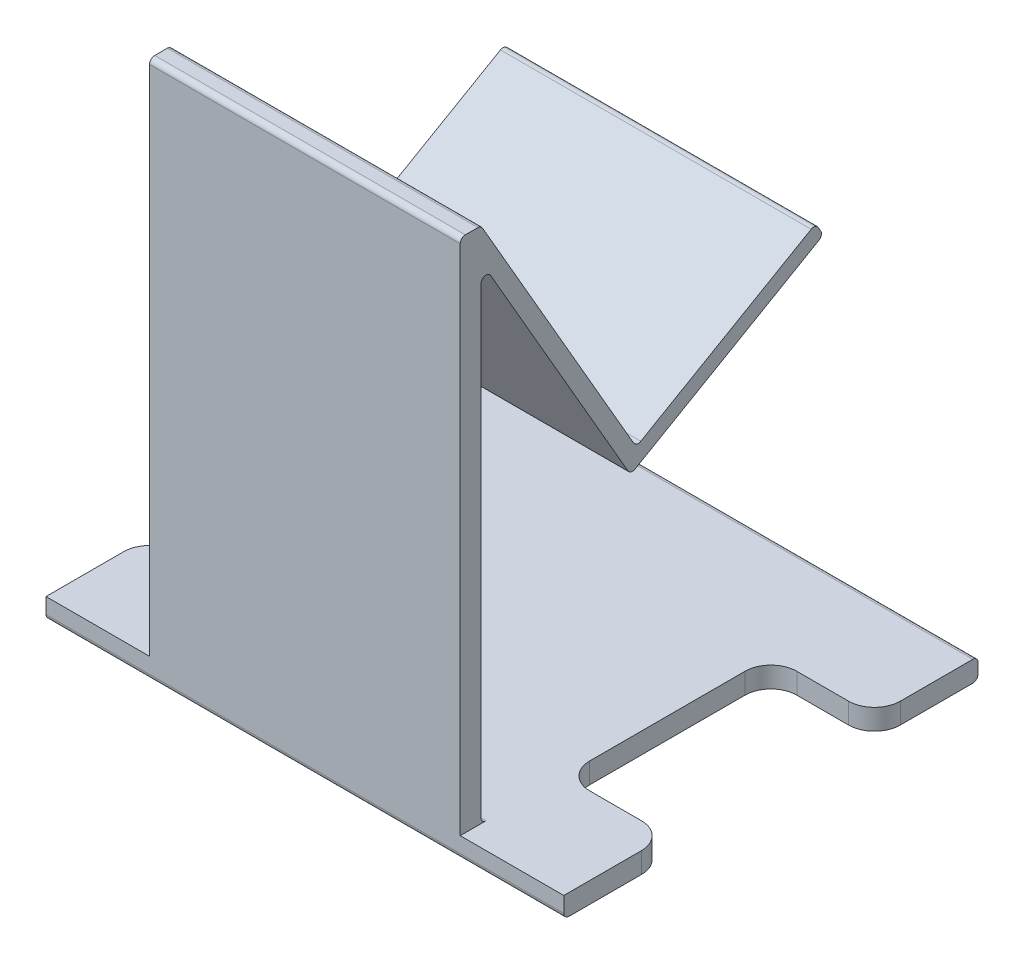
from build123d import *

# Parameters (mm, degrees)
EXTRUDE_1_DEPTH = 30
EXTRUDE_2_DEPTH = 50
FILLET_1_R      = 5


with BuildPart() as part:
    # 草图1 → 凸台-拉伸1 (new, symmetric)
    with BuildSketch(Plane(origin=(0, 0, 0), x_dir=(0, 0, -1), z_dir=(1, 0, 0))):
        with BuildLine():
            Line((33.5, 52.904501177), (4.288675135, 103.5))
            ThreePointArc((4.288675135, 103.5), (3.922649731, 103.866025404), (3.422649731, 104))
            Line((3.422649731, 104), (1, 104))
            ThreePointArc((1, 104), (0.292893219, 103.707106781), (0, 103))
            Line((0, 103), (0, 1))
            ThreePointArc((0, 1), (0.292893219, 0.292893219), (1, 0))
            Line((1, 0), (79, 0))
            ThreePointArc((79, 0), (79.707106781, 0.292893219), (80, 1))
            Line((80, 1), (80, 3))
            ThreePointArc((80, 3), (79.707106781, 3.707106781), (79, 4))
            Line((79, 4), (5, 4))
            ThreePointArc((5, 4), (4.292893219, 4.292893219), (4, 5))
            Line((4, 5), (4, 94.267949192))
            ThreePointArc((4, 94.267949192), (4.741180955, 95.233875019), (5.866025404, 94.767949192))
            Line((5.866025404, 94.767949192), (32.401923789, 48.806424965))
            ThreePointArc((32.401923789, 48.806424965), (33.009130147, 48.340499139), (33.767949192, 48.440399562))
            Line((33.767949192, 48.440399562), (69.274990748, 68.940399562))
            ThreePointArc((69.274990748, 68.940399562), (69.740916574, 69.54760592), (69.641016151, 70.306424965))
            Line((69.641016151, 70.306424965), (69.141016151, 71.172450369))
            ThreePointArc((69.141016151, 71.172450369), (68.533809793, 71.638376195), (67.774990748, 71.538475773))
            Line((67.774990748, 71.538475773), (34.866025404, 52.538475773))
            ThreePointArc((34.866025404, 52.538475773), (34.107206359, 52.43857535), (33.5, 52.904501177))
        make_face()
    extrude(amount=EXTRUDE_1_DEPTH, both=True)

    # 草图1<4> → 凸台-拉伸2 (add, symmetric)
    with BuildSketch(Plane(origin=(0, 0, 0), x_dir=(0, 0, -1), z_dir=(1, 0, 0))):
        with BuildLine():
            Line((20, 4), (0, 4))
            Line((0, 4), (0, 1))
            ThreePointArc((0, 1), (0.292893219, 0.292893219), (1, 0))
            Line((1, 0), (20, 0))
            Line((20, 0), (20, 4))
        make_face()
        with BuildLine():
            Line((79, 4), (60, 4))
            Line((60, 4), (60, 0))
            Line((60, 0), (79, 0))
            ThreePointArc((79, 0), (79.707106781, 0.292893219), (80, 1))
            Line((80, 1), (80, 3))
            ThreePointArc((80, 3), (79.707106781, 3.707106781), (79, 4))
        make_face()
    extrude(amount=EXTRUDE_2_DEPTH, both=True)

    # 圆角1
    fillet_1_edges = [part.edges().sort_by_distance(p)[0] for p in [
        (-50, 2, -20),
        (-30, 2, -20),
        (-50, 2, -60),
        (-30, 2, -60),
        (50, 2, -20),
        (50, 2, -60),
        (30, 2, -60),
        (30, 2, -20),
    ]]
    fillet(fillet_1_edges, radius=FILLET_1_R)


solid = part.part
